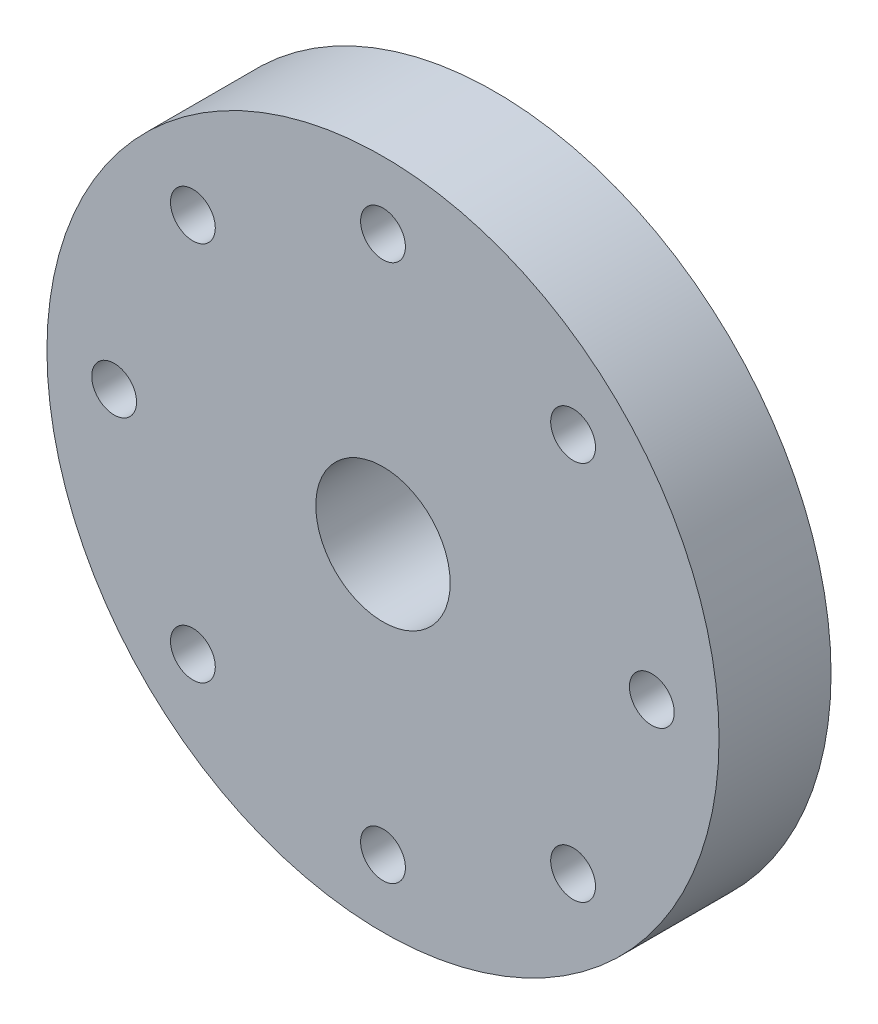
from build123d import *

# Parameters (mm, degrees)
SKETCH1_R           = 15
SKETCH1_R_2         = 1
SKETCH1_R_3         = 1.000000019
SKETCH1_R_4         = 3
BOSS_EXTRUDE1_DEPTH = 5


with BuildPart() as part:
    # Sketch1 → Boss-Extrude1 (new body)
    with BuildSketch(Plane.XY):
        with Locations((-0.041510791, -0.108617644)):
            Circle(SKETCH1_R)
        with Locations((-0.041510791, 11.891382356)):
            Circle(SKETCH1_R_2, mode=Mode.SUBTRACT)
        with Locations((8.443770584, 8.37666373)):
            Circle(SKETCH1_R_2, mode=Mode.SUBTRACT)
        with Locations((11.958489209, -0.108617664)):
            Circle(SKETCH1_R_3, mode=Mode.SUBTRACT)
        with Locations((-0.041510791, -12.108617644)):
            Circle(SKETCH1_R_2, mode=Mode.SUBTRACT)
        with Locations((8.443770584, -8.593899018)):
            Circle(SKETCH1_R_2, mode=Mode.SUBTRACT)
        with Locations((-8.526792165, -8.593899018)):
            Circle(SKETCH1_R_2, mode=Mode.SUBTRACT)
        with Locations((-12.041510791, -0.108617644)):
            Circle(SKETCH1_R_2, mode=Mode.SUBTRACT)
        with Locations((-8.526792165, 8.37666373)):
            Circle(SKETCH1_R_2, mode=Mode.SUBTRACT)
        with Locations((-0.041510791, -0.108617644)):
            Circle(SKETCH1_R_4, mode=Mode.SUBTRACT)
    extrude(amount=BOSS_EXTRUDE1_DEPTH)


solid = part.part
